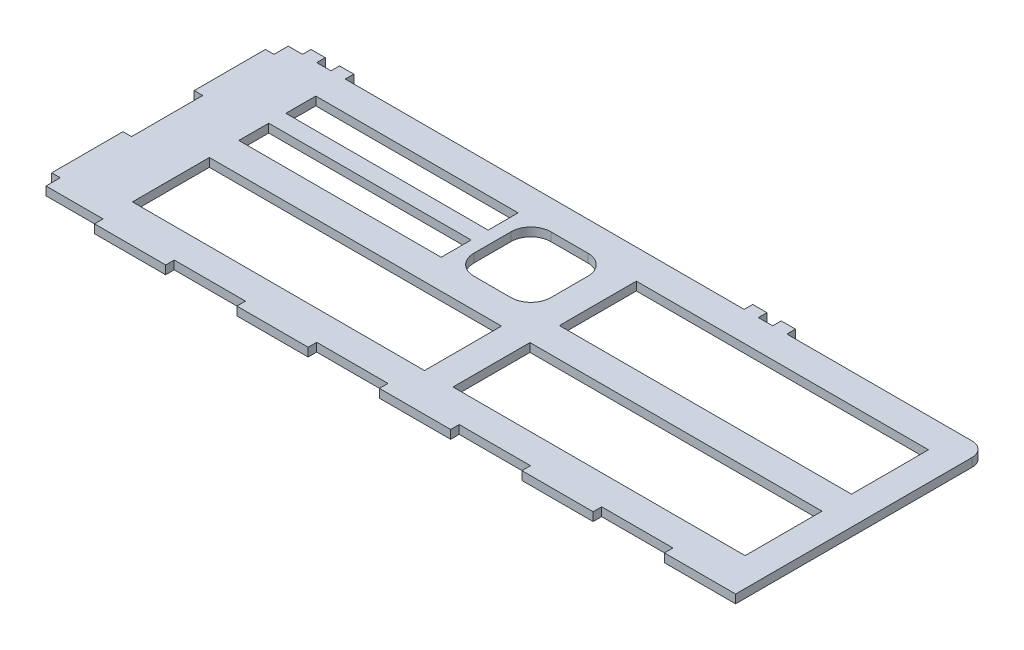
from build123d import *

# Parameters (mm, degrees)
SKICA1_W                = 245
SKICA1_H                = 85
SKICA1_W_2              = 102.5
SKICA1_H_2              = 27
SKICA1_W_3              = 71
SKICA1_H_3              = 10.5
P_IDAT_VYSUNUT_M1_DEPTH = 3
SKICA2_W                = 3
SKICA2_H                = 25
SKICA2_W_2              = 25
SKICA2_H_2              = 3
P_IDAT_VYSUNUT_M2_DEPTH = 3
SKICA3_W                = 5
SKICA3_H                = 3
P_IDAT_VYSUNUT_M3_DEPTH = 3
ZAOBLIT1_R              = 5
SKICA7_W                = 5
SKICA7_H                = 3
P_IDAT_VYSUNUT_M6_DEPTH = 3


with BuildPart() as part:
    # Skica1 → Přidat vysunutím1 (new body)
    with BuildSketch(Plane(origin=(0, 0, 0), x_dir=(1, 0, 0), z_dir=(0, 1, 0))):
        with Locations((122.5, 42.5)):
            Rectangle(SKICA1_W, SKICA1_H)
        with Locations((71.25, 23.833333333)):
            Rectangle(SKICA1_W_2, SKICA1_H_2, mode=Mode.SUBTRACT)
        with Locations((55.5, 69.416666667)):
            Rectangle(SKICA1_W_3, SKICA1_H_3, mode=Mode.SUBTRACT)
        with Locations((183.75, 23.833333333)):
            Rectangle(SKICA1_W_2, SKICA1_H_2, mode=Mode.SUBTRACT)
        with Locations((183.75, 61.166666667)):
            Rectangle(SKICA1_W_2, SKICA1_H_2, mode=Mode.SUBTRACT)
        with BuildLine():
            Line((102.5, 74.666666667), (115.5, 74.666666667))
            ThreePointArc((115.5, 74.666666667), (120.449747468, 72.616414135), (122.5, 67.666666667))
            Line((122.5, 67.666666667), (122.5, 54.666666667))
            ThreePointArc((122.5, 54.666666667), (120.449747468, 49.716919198), (115.5, 47.666666667))
            Line((115.5, 47.666666667), (102.5, 47.666666667))
            ThreePointArc((102.5, 47.666666667), (97.550252532, 49.716919198), (95.5, 54.666666667))
            Line((95.5, 54.666666667), (95.5, 67.666666667))
            ThreePointArc((95.5, 67.666666667), (97.550252532, 72.616414135), (102.5, 74.666666667))
        make_face(mode=Mode.SUBTRACT)
        with Locations((55.5, 52.916666667)):
            Rectangle(SKICA1_W_3, SKICA1_H_3, mode=Mode.SUBTRACT)
    extrude(amount=P_IDAT_VYSUNUT_M1_DEPTH)

    # Skica2 → Přidat vysunutím2 (add)
    with BuildSketch(Plane(origin=(0, 0, 0), x_dir=(1, 0, 0), z_dir=(0, 1, 0))):
        with Locations((-1.5, 17.5)):
            Rectangle(SKICA2_W, SKICA2_H)
        with Locations((-1.5, 67.5)):
            Rectangle(SKICA2_W, SKICA2_H)
        with Locations((232.5, -1.5)):
            Rectangle(SKICA2_W_2, SKICA2_H_2)
        with Locations((182.5, -1.5)):
            Rectangle(SKICA2_W_2, SKICA2_H_2)
        with Locations((132.5, -1.5)):
            Rectangle(SKICA2_W_2, SKICA2_H_2)
        with Locations((82.5, -1.5)):
            Rectangle(SKICA2_W_2, SKICA2_H_2)
        with Locations((32.5, -1.5)):
            Rectangle(SKICA2_W_2, SKICA2_H_2)
    extrude(amount=P_IDAT_VYSUNUT_M2_DEPTH)

    # Skica3 → Přidat vysunutím3 (add)
    with BuildSketch(Plane(origin=(0, 0, 0), x_dir=(1, 0, 0), z_dir=(0, 1, 0))):
        with Locations((7.5, 86.5)):
            Rectangle(SKICA3_W, SKICA3_H)
        with Locations((17.5, 86.5)):
            Rectangle(SKICA3_W, SKICA3_H)
    extrude(amount=P_IDAT_VYSUNUT_M3_DEPTH)

    # Zaoblit1
    zaoblit1_edges = [part.edges().sort_by_distance(p)[0] for p in [
        (245, 1.5, -85),
    ]]
    fillet(zaoblit1_edges, radius=ZAOBLIT1_R)

    # Skica7 → Přidat vysunutím6 (add)
    with BuildSketch(Plane(origin=(0, 0, 0), x_dir=(1, 0, 0), z_dir=(0, 1, 0))):
        with Locations((162.5, 86.5)):
            Rectangle(SKICA7_W, SKICA7_H)
        with Locations((172.5, 86.5)):
            Rectangle(SKICA7_W, SKICA7_H)
    extrude(amount=P_IDAT_VYSUNUT_M6_DEPTH)


solid = part.part
